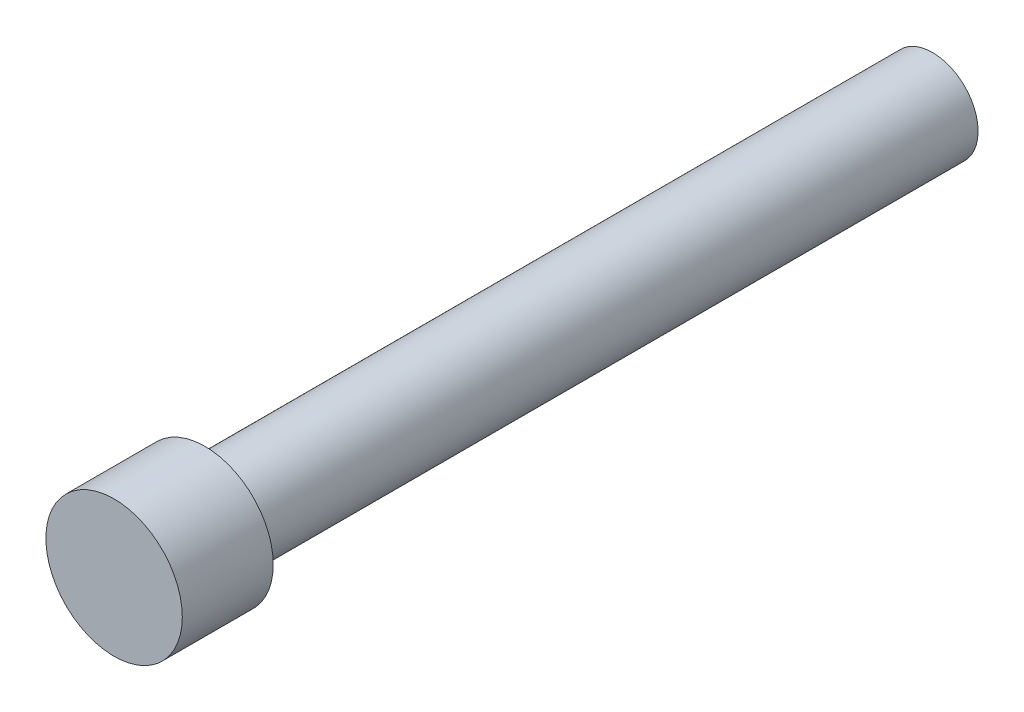
from build123d import *

# Parameters (mm, degrees)
SKETCH_1_R      = 1.5
EXTRUDE_1_DEPTH = 2
SKETCH_2_R      = 1
EXTRUDE_3_DEPTH = 16


with BuildPart() as part:
    # 草图1 → 凸台-拉伸1 (new body)
    with BuildSketch(Plane.XY):
        Circle(SKETCH_1_R)
    extrude(amount=EXTRUDE_1_DEPTH)

    # 草图2 → 凸台-拉伸3 (add)
    with BuildSketch(Plane(origin=(0, 0, 0), x_dir=(-1, 0, 0), z_dir=(0, 0, -1))):
        Circle(SKETCH_2_R)
    extrude(amount=EXTRUDE_3_DEPTH)


solid = part.part
